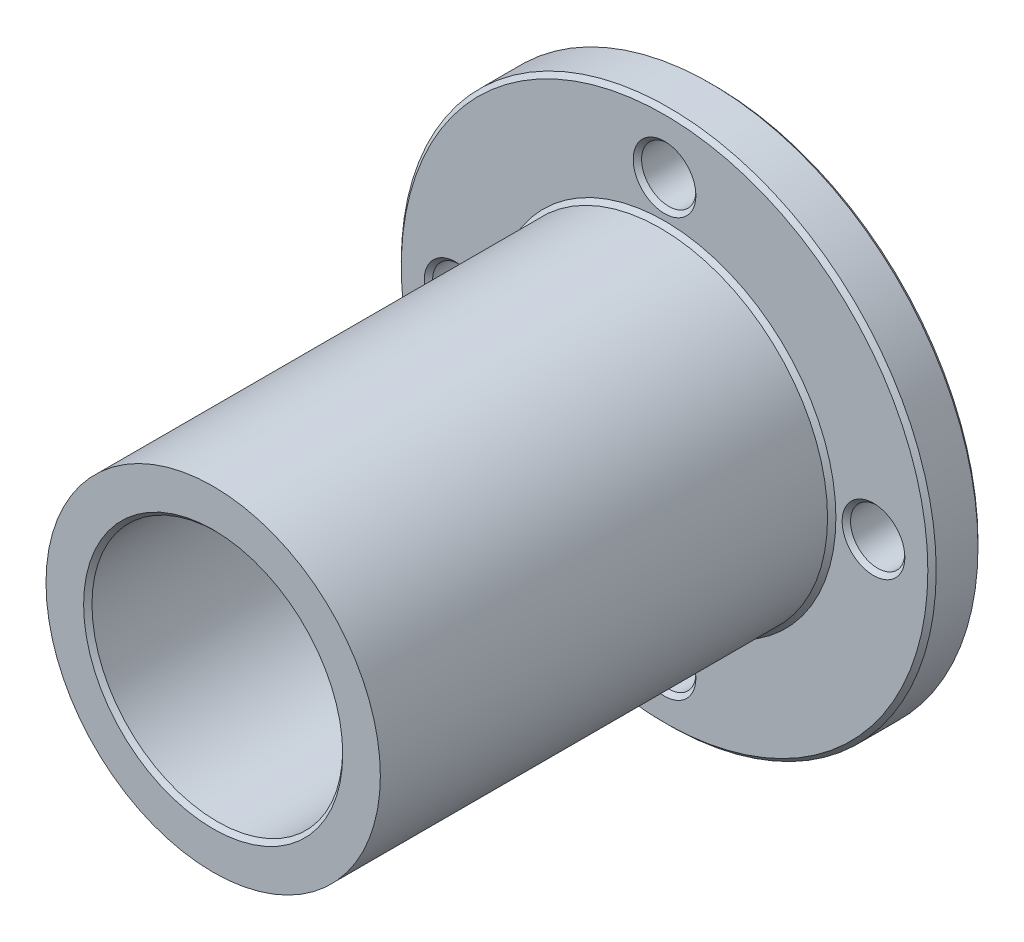
from build123d import *

# Parameters (mm, degrees)
SKETCH1_R                               = 32
SKETCH1_R_2                             = 20
BOSS_EXTRUDE1_DEPTH                     = 6
SKETCH1_2_R                             = 20
BOSS_EXTRUDE2_DEPTH                     = 60
CBORE_FOR_M6_HEX_HEAD_BOLT1_D           = 30
CBORE_FOR_M6_HEX_HEAD_BOLT1_CBORE_D     = 40
CBORE_FOR_M6_HEX_HEAD_BOLT1_CBORE_DEPTH = 2.3
SKETCH7_R                               = 3.25
CUT_EXTRUDE1_DEPTH                      = 6
CHAMFER1_SIZE                           = 0.5


with BuildPart() as part:
    # Sketch1 → Boss-Extrude1 (new body)
    with BuildSketch(Plane.XY):
        Circle(SKETCH1_R)
        Circle(SKETCH1_R_2, mode=Mode.SUBTRACT)
    extrude(amount=BOSS_EXTRUDE1_DEPTH)

    # Sketch1<2> → Boss-Extrude2 (add)
    with BuildSketch(Plane.XY):
        Circle(SKETCH1_2_R)
    extrude(amount=BOSS_EXTRUDE2_DEPTH)

    # CBORE for M6 Hex Head Bolt1 (through all)
    with Locations(Plane(origin=(0, 0, 0), x_dir=(-1, 0, 0), z_dir=(0, 0, -1))):
        with Locations((0, 0)):
            CounterBoreHole(CBORE_FOR_M6_HEX_HEAD_BOLT1_D / 2, CBORE_FOR_M6_HEX_HEAD_BOLT1_CBORE_D / 2, CBORE_FOR_M6_HEX_HEAD_BOLT1_CBORE_DEPTH)

    # Sketch7 → Cut-Extrude1 (cut)
    with BuildSketch(Plane(origin=(0, 0, 0), x_dir=(-1, 0, 0), z_dir=(0, 0, -1))):
        with Locations((0, 25)):
            Circle(SKETCH7_R)
        with Locations((25, 0)):
            Circle(SKETCH7_R)
        with Locations((0, -25)):
            Circle(SKETCH7_R)
        with Locations((-25, 0)):
            Circle(SKETCH7_R)
    extrude(amount=-CUT_EXTRUDE1_DEPTH, mode=Mode.SUBTRACT)

    # Chamfer1
    chamfer1_edges = [part.edges().sort_by_distance(p)[0] for p in [
        (-32, 0, 0),
        (20, 0, 0),
        (28.25, 0, 0),
        (3.25, -25, 0),
        (-21.75, 0, 0),
        (3.25, 25, 0),
        (-20, 0, 6),
        (-32, 0, 6),
        (28.25, 0, 6),
        (3.25, -25, 6),
        (-21.75, 0, 6),
        (3.25, 25, 6),
        (-15, 0, 60),
    ]]
    chamfer(chamfer1_edges, length=CHAMFER1_SIZE)


solid = part.part
